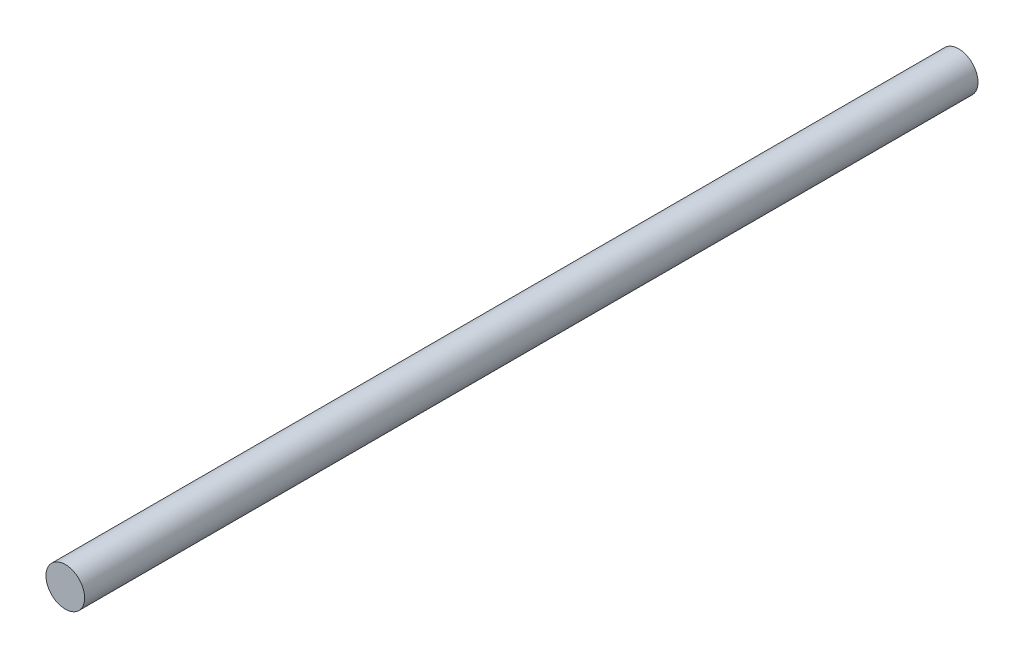
from build123d import *

# Parameters (mm, degrees)
CROQUIS1_R              = 6.5
SALIENTE_EXTRUIR1_DEPTH = 300


with BuildPart() as part:
    # Croquis1 → Saliente-Extruir1 (new body)
    with BuildSketch(Plane.XY):
        Circle(CROQUIS1_R)
    extrude(amount=SALIENTE_EXTRUIR1_DEPTH)


solid = part.part
